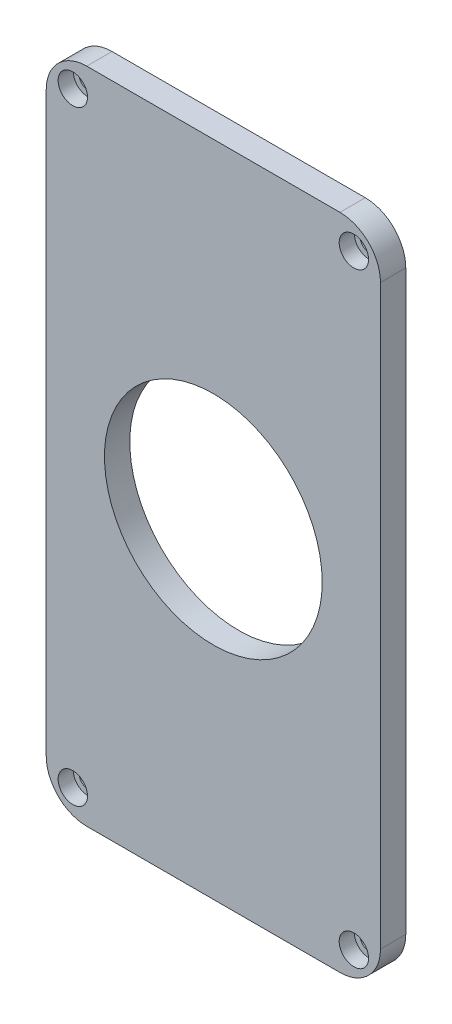
from build123d import *

# Parameters (mm, degrees)
BOSS_EXTRUDE1_DEPTH = 5
SKETCH2_R           = 21.5
CUT_EXTRUDE1_DEPTH  = 74.068461049
SKETCH12_R          = 2.9
CUT_EXTRUDE3_DEPTH  = 3
SKETCH13_R          = 1.75
CUT_EXTRUDE4_DEPTH  = 73.958892535


with BuildPart() as part:
    # Sketch1 → Boss-Extrude1 (new body)
    with BuildSketch(Plane.XY):
        with BuildLine():
            Line((25, 65), (-25, 65))
            ThreePointArc((-25, 65), (-30.656854249, 62.656854249), (-33, 57))
            Line((-33, 57), (-33, -57))
            ThreePointArc((-33, -57), (-30.656854249, -62.656854249), (-25, -65))
            Line((-25, -65), (25, -65))
            ThreePointArc((25, -65), (30.656854249, -62.656854249), (33, -57))
            Line((33, -57), (33, 57))
            ThreePointArc((33, 57), (30.656854249, 62.656854249), (25, 65))
        make_face()
    extrude(amount=BOSS_EXTRUDE1_DEPTH)

    # Sketch2 → Cut-Extrude1 (cut, through all)
    with BuildSketch(Plane.XY.offset(5)):
        Circle(SKETCH2_R)
    extrude(amount=-CUT_EXTRUDE1_DEPTH, mode=Mode.SUBTRACT)

    # Sketch12 → Cut-Extrude3 (cut)
    with BuildSketch(Plane.XY.offset(5)):
        with Locations((-27.75, 59.75)):
            Circle(SKETCH12_R)
        with Locations(Location((27.75, 59.75, 0), (0, 0, 180))):
            Circle(SKETCH12_R)
        with Locations(Location((-27.75, -59.75, 0), (0, 0, 180))):
            Circle(SKETCH12_R)
        with Locations((27.75, -59.75)):
            Circle(SKETCH12_R)
    extrude(amount=-CUT_EXTRUDE3_DEPTH, mode=Mode.SUBTRACT)

    # Sketch13 → Cut-Extrude4 (cut, through all)
    with BuildSketch(Plane.XY.offset(2)):
        with Locations((-27.75, 59.75)):
            Circle(SKETCH13_R)
        with Locations(Location((27.75, 59.75, 0), (0, 0, 180))):
            Circle(SKETCH13_R)
        with Locations((27.75, -59.75)):
            Circle(SKETCH13_R)
        with Locations(Location((-27.75, -59.75, 0), (0, 0, 180))):
            Circle(SKETCH13_R)
    extrude(amount=-CUT_EXTRUDE4_DEPTH, mode=Mode.SUBTRACT)


solid = part.part
